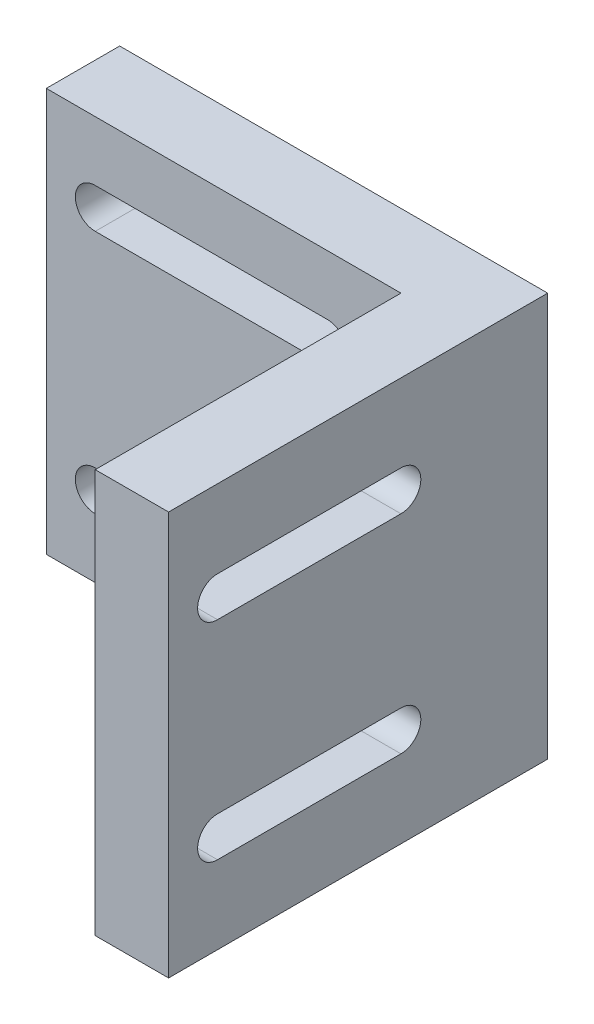
from build123d import *

# Parameters (mm, degrees)
SKETCH_1_W          = 70
SKETCH_1_H          = 66
EXTRUDE_1_DEPTH     = 12
SKETCH_2_W          = 12
SKETCH_2_H          = 66
EXTRUDE_2_DEPTH     = 50
CUT_EXTRUDE_1_DEPTH = 40
CUT_EXTRUDE_2_DEPTH = 40


with BuildPart() as part:
    # 草图1 → 凸台-拉伸1 (new body)
    with BuildSketch(Plane.XY):
        with Locations((35, 33)):
            Rectangle(SKETCH_1_W, SKETCH_1_H)
    extrude(amount=EXTRUDE_1_DEPTH)

    # 草图2 → 凸台-拉伸2 (add)
    with BuildSketch(Plane.XY.offset(12)):
        with Locations((64, 33)):
            Rectangle(SKETCH_2_W, SKETCH_2_H)
    extrude(amount=EXTRUDE_2_DEPTH)

    # 草图3 → 切除-拉伸1 (cut)
    with BuildSketch(Plane.ZY.offset(-58)):
        with BuildLine():
            Line((24, 19.25), (54, 19.25))
            ThreePointArc((54, 19.25), (57.25, 16), (54, 12.75))
            Line((54, 12.75), (24, 12.75))
            ThreePointArc((24, 12.75), (20.75, 16), (24, 19.25))
        make_face()
        with BuildLine():
            Line((24, 46.75), (54, 46.75))
            ThreePointArc((54, 46.75), (57.25, 50), (54, 53.25))
            Line((54, 53.25), (24, 53.25))
            ThreePointArc((24, 53.25), (20.75, 50), (24, 46.75))
        make_face()
    extrude(amount=-CUT_EXTRUDE_1_DEPTH, mode=Mode.SUBTRACT)

    # 草图6 → 切除-拉伸2 (cut)
    with BuildSketch(Plane.XY.offset(12)):
        with BuildLine():
            Line((8, 16.25), (46, 16.25))
            ThreePointArc((46, 16.25), (49.25, 13), (46, 9.75))
            Line((46, 9.75), (8, 9.75))
            ThreePointArc((8, 9.75), (4.75, 13), (8, 16.25))
        make_face()
        with BuildLine():
            Line((8, 49.75), (46, 49.75))
            ThreePointArc((46, 49.75), (49.25, 53), (46, 56.25))
            Line((46, 56.25), (8, 56.25))
            ThreePointArc((8, 56.25), (4.75, 53), (8, 49.75))
        make_face()
    extrude(amount=-CUT_EXTRUDE_2_DEPTH, mode=Mode.SUBTRACT)


solid = part.part
